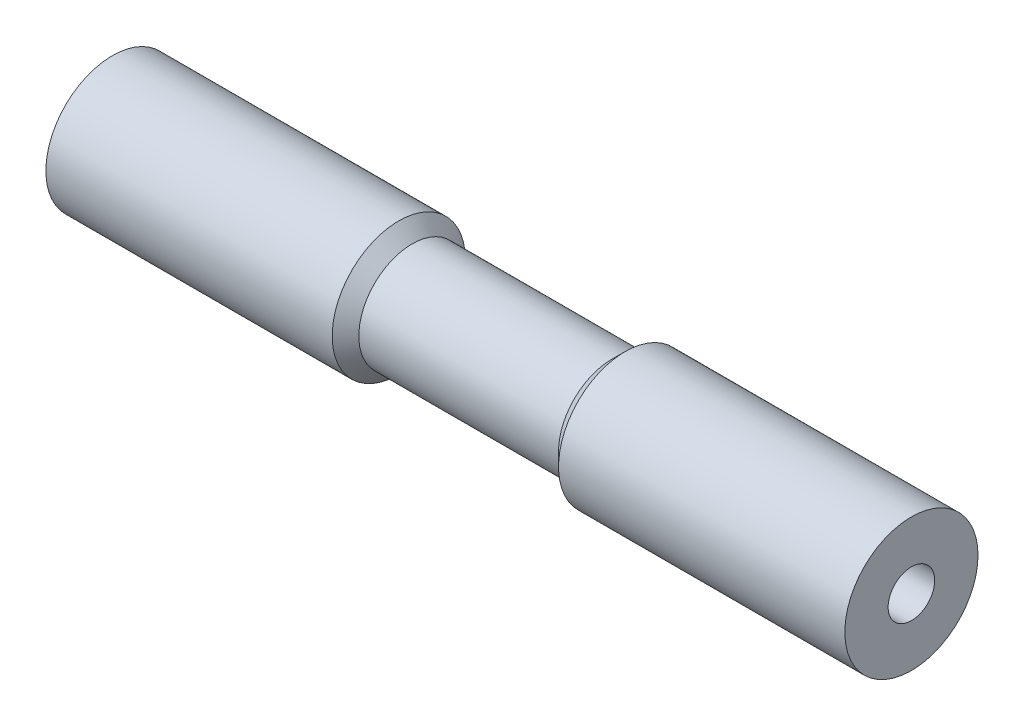
from build123d import *

# Parameters (mm, degrees)
CUT_EXTRUDE1_DEPTH = 20
SKETCH5_R          = 3.5
CUT_EXTRUDE2_DEPTH = 50


with BuildPart() as part:
    # Sketch2 → Revolve1 (revolve)
    with BuildSketch(Plane.XY, mode=Mode.PRIVATE) as revolve1_sk:
        Polygon((0, 0), (0, 10), (43, 10), (45, 8), (75, 8), (77, 10), (120, 10), (120, 4), (120, 0), align=None)
    revolve(revolve1_sk.sketch.rotate(Axis((120, 0, 0), (-1, 0, 0)), 90), axis=Axis((120, 0, 0), (-1, 0, 0)))

    # Sketch3 → Cut-Extrude1 (cut)
    with BuildSketch(Plane.ZY):
        with BuildLine():
            Line((-1.183215957, 1.15), (1.183215957, 1.15))
            ThreePointArc((1.183215957, 1.15), (0, -1.65), (-1.183215957, 1.15))
        make_face()
    extrude(amount=-CUT_EXTRUDE1_DEPTH, mode=Mode.SUBTRACT)

    # Sketch5 → Cut-Extrude2 (cut)
    with BuildSketch(Plane(origin=(120, 0, 0), x_dir=(0, 0, -1), z_dir=(1, 0, 0))):
        Circle(SKETCH5_R)
    extrude(amount=-CUT_EXTRUDE2_DEPTH, mode=Mode.SUBTRACT)


solid = part.part
